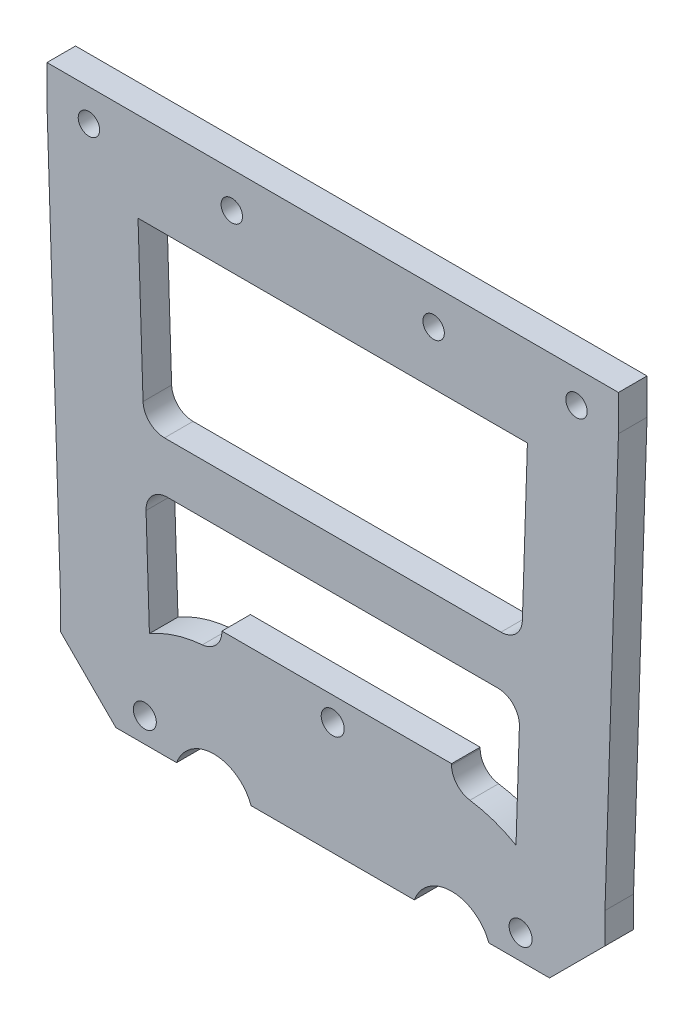
from build123d import *

# Parameters (mm, degrees)
SKETCH1_R           = 1.610311209
SKETCH1_R_2         = 1.5
BOSS_EXTRUDE1_DEPTH = 4
FILLET1_R           = 3


with BuildPart() as part:
    # Sketch1 → Boss-Extrude1 (new body)
    with BuildSketch(Plane.XY):
        with BuildLine():
            Line((-38.110698604, 1.610311209), (-30.354366282, -6.146021113))
            Line((-30.354366282, -6.146021113), (-21.854366282, -6.146021113))
            ThreePointArc((-21.854366282, -6.146021113), (-16.639882489, -2.482124138), (-11.425398696, -6.146021113))
            Line((-11.425398696, -6.146021113), (11.425398696, -6.146021113))
            ThreePointArc((11.425398696, -6.146021113), (16.639882489, -2.482124138), (21.854366282, -6.146021113))
            Line((21.854366282, -6.146021113), (30.354366282, -6.146021113))
            Line((30.354366282, -6.146021113), (38.110698604, 1.610311209))
            Line((38.110698604, 1.610311209), (38.110698604, 5.904474432))
            Line((38.110698604, 5.904474432), (40, 64.661867252))
            Line((40, 64.661867252), (40, 69.661867252))
            Line((40, 69.661867252), (-40, 69.661867252))
            Line((-40, 69.661867252), (-40, 64.661867252))
            Line((-40, 64.661867252), (-38.110698604, 5.904474432))
            Line((-38.110698604, 5.904474432), (-38.110698604, 1.610311209))
        make_face()
        with Locations((0, 9.661867252)):
            Circle(SKETCH1_R, mode=Mode.SUBTRACT)
        with Locations((-26.301749741, -2.683852014)):
            Circle(SKETCH1_R, mode=Mode.SUBTRACT)
        with Locations((26.301749741, -2.683852014)):
            Circle(SKETCH1_R, mode=Mode.SUBTRACT)
        with Locations((34.124535685, 65.161867252)):
            Circle(SKETCH1_R_2, mode=Mode.SUBTRACT)
        with Locations((14.124535685, 64.661867252)):
            Circle(SKETCH1_R_2, mode=Mode.SUBTRACT)
        with Locations((-14.124535685, 64.661867252)):
            Circle(SKETCH1_R_2, mode=Mode.SUBTRACT)
        with Locations((-34.124535685, 65.161867252)):
            Circle(SKETCH1_R_2, mode=Mode.SUBTRACT)
        Polygon((-27.252382744, 57.161867252), (-26.45560174, 32.381927681), (26.45560174, 32.381927681), (27.252382744, 57.161867252), align=None, mode=Mode.SUBTRACT)
        with BuildLine():
            Line((25.658820737, 7.60198811), (26.230521812, 25.381927681))
            Line((26.230521812, 25.381927681), (-26.230521812, 25.381927681))
            Line((-26.230521812, 25.381927681), (-25.658820737, 7.60198811))
            ThreePointArc((-25.658820737, 7.60198811), (-20.760848223, 9.540954041), (-15.511590599, 9.98256249))
            Line((-15.511590599, 9.98256249), (-15.511590599, 12.98256249))
            Line((-15.511590599, 12.98256249), (16.639882489, 12.98256249))
            Line((16.639882489, 12.98256249), (16.639882489, 10.017875862))
            ThreePointArc((16.639882489, 10.017875862), (21.308334072, 9.403441757), (25.658820737, 7.60198811))
        make_face(mode=Mode.SUBTRACT)
    extrude(amount=BOSS_EXTRUDE1_DEPTH)

    # Fillet1
    fillet1_edges = [part.edges().sort_by_distance(p)[0] for p in [
        (-26.45560174, 32.381927681, 2),
        (26.45560174, 32.381927681, 2),
        (-26.230521812, 25.381927681, 2),
        (-15.511590599, 9.98256249, 2),
        (16.639882489, 10.017875862, 2),
        (26.230521812, 25.381927681, 2),
    ]]
    fillet(fillet1_edges, radius=FILLET1_R)


solid = part.part
